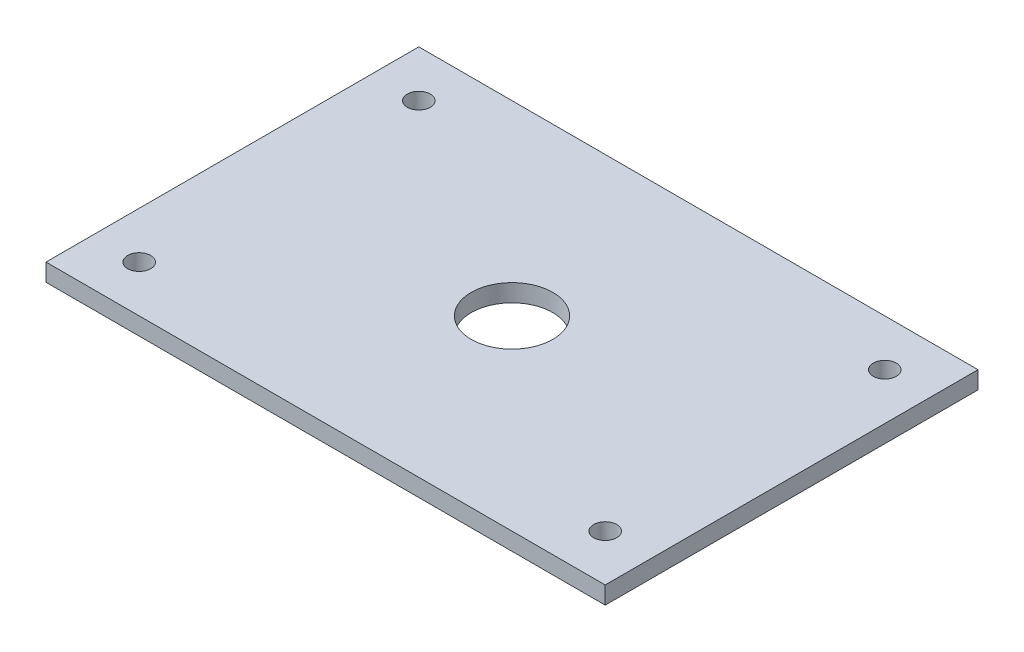
from build123d import *

# Parameters (mm, degrees)
SKETCH1_W           = 152.4
SKETCH1_H           = 101.6
BOSS_EXTRUDE1_DEPTH = 4.7752
SKETCH2_R           = 3.1369
SKETCH2_R_2         = 11.1125
CUT_EXTRUDE1_DEPTH  = 4.7752


with BuildPart() as part:
    # Sketch1 → Boss-Extrude1 (new body)
    with BuildSketch(Plane(origin=(0, 0, 0), x_dir=(1, 0, 0), z_dir=(0, 1, 0))):
        with Locations((18.763963964, -21.50990991)):
            Rectangle(SKETCH1_W, SKETCH1_H)
    extrude(amount=BOSS_EXTRUDE1_DEPTH)

    # Sketch2 → Cut-Extrude1 (cut)
    with BuildSketch(Plane(origin=(0, 4.7752, 0), x_dir=(1, 0, 0), z_dir=(0, 1, 0))):
        with Locations(Location((-44.736036036, 16.59009009, 0), (0, 0, 270))):
            Circle(SKETCH2_R)
        with Locations(Location((82.263963964, 16.59009009, 0), (0, 0, 270))):
            Circle(SKETCH2_R)
        with Locations(Location((82.263963964, -59.60990991, 0), (0, 0, 270))):
            Circle(SKETCH2_R)
        with Locations(Location((-44.736036036, -59.60990991, 0), (0, 0, 270))):
            Circle(SKETCH2_R)
        with Locations(Location((18.763963964, -21.50990991, 0), (0, 0, 270))):
            Circle(SKETCH2_R_2)
    extrude(amount=-CUT_EXTRUDE1_DEPTH, mode=Mode.SUBTRACT)


solid = part.part
